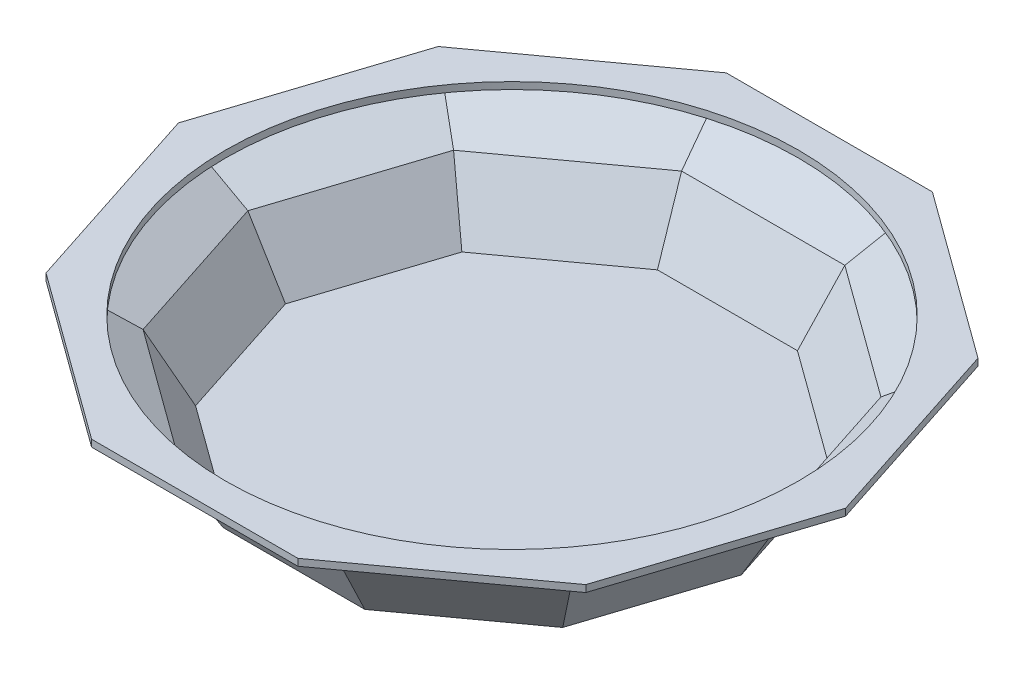
from build123d import *

# Parameters (mm, degrees)
STAGE1EX_DEPTH      = 30
STAGE1EX_DRAFT      = -30
STAGE1IN_DEPTH      = 27
STAGE1IN_DRAFT      = -30
STAGE2EX_DEPTH      = 15
STAGE2EX_DRAFT      = -60
STAGE2IN_DEPTH      = 20
STAGE2IN_DRAFT      = -60
SKETCH11_R          = 125
BOSS_EXTRUDE6_DEPTH = 3


with BuildPart() as part:
    # Sketch4 → Stage1Ex (with draft: the straight prism first)
    with BuildSketch(Plane(origin=(0, 0, 0), x_dir=(1, 0, 0), z_dir=(0, 1, 0))):
        Polygon((30.901699437, -95.10565163), (80.901699437, -58.778525229), (100, 0), (80.901699437, 58.778525229), (30.901699437, 95.10565163), (-30.901699437, 95.10565163), (-80.901699437, 58.778525229), (-100, 0), (-80.901699437, -58.778525229), (-30.901699437, -95.10565163), align=None)
    extrude(amount=STAGE1EX_DEPTH)
    # Stage1Ex: the draft: its side faces are tilted about the plane it starts from
    stage1ex_sides = [part.faces().sort_by_distance(p)[0] for p in [
        (55.901699437, 15, 76.942088429),
        (90.450849719, 15, 29.389262615),
        (90.450849719, 15, -29.389262615),
        (55.901699437, 15, -76.942088429),
        (0, 15, -95.10565163),
        (-55.901699437, 15, -76.942088429),
        (-90.450849719, 15, -29.389262615),
        (-90.450849719, 15, 29.389262615),
        (-55.901699437, 15, 76.942088429),
        (0, 15, 95.10565163),
    ]]
    draft(stage1ex_sides, Plane(origin=(0, 0, 0), x_dir=(1, 0, 0), z_dir=(0, 1, 0)), STAGE1EX_DRAFT)


with BuildPart() as stage1in_tool:
    # Sketch7 → Stage1In (with draft: the straight prism first)
    with BuildSketch(Plane(origin=(0, 30, 0), x_dir=(1, 0, 0), z_dir=(0, 1, 0))):
        Polygon((-115.211859946, 0), (-93.20835265, -67.719832166), (-35.602422677, -109.572990156), (35.602422677, -109.572990156), (93.20835265, -67.719832166), (115.211859946, 0), (93.20835265, 67.719832166), (35.602422677, 109.572990156), (-35.602422677, 109.572990156), (-93.20835265, 67.719832166), align=None)
    extrude(amount=-STAGE1IN_DEPTH)
    # Stage1In: the draft: its side faces are tilted about the plane it starts from
    stage1in_sides = [stage1in_tool.faces().sort_by_distance(p)[0] for p in [
        (-104.210106298, 16.5, 33.859916083),
        (-64.405387663, 16.5, 88.646411161),
        (0, 16.5, 109.572990156),
        (64.405387663, 16.5, 88.646411161),
        (104.210106298, 16.5, 33.859916083),
        (104.210106298, 16.5, -33.859916083),
        (64.405387663, 16.5, -88.646411161),
        (0, 16.5, -109.572990156),
        (-64.405387663, 16.5, -88.646411161),
        (-104.210106298, 16.5, -33.859916083),
    ]]
    draft(stage1in_sides, Plane(origin=(0, 30, 0), x_dir=(1, 0, 0), z_dir=(0, 1, 0)), STAGE1IN_DRAFT)


with BuildPart() as part_1:
    add(part.part)

    # Stage1In: cut by stage1in_tool
    add(stage1in_tool.part, mode=Mode.SUBTRACT)


with BuildPart() as stage2ex_tool:
    # Sketch8 → Stage2Ex (with draft: the straight prism first)
    with BuildSketch(Plane(origin=(0, 30, 0), x_dir=(1, 0, 0), z_dir=(0, 1, 0))):
        Polygon((36.52947366, 112.426159705), (-36.52947366, 112.426159705), (-95.635403633, 69.483187922), (-118.211859946, 0), (-95.635403633, -69.483187922), (-36.52947366, -112.426159705), (36.52947366, -112.426159705), (95.635403633, -69.483187922), (118.211859946, 0), (95.635403633, 69.483187922), align=None)
    extrude(amount=STAGE2EX_DEPTH)
    # Stage2Ex: the draft: its side faces are tilted about the plane it starts from
    stage2ex_sides = [stage2ex_tool.faces().sort_by_distance(p)[0] for p in [
        (0, 37.5, -112.426159705),
        (-66.082438647, 37.5, -90.954673814),
        (-106.92363179, 37.5, -34.741593961),
        (-106.92363179, 37.5, 34.741593961),
        (-66.082438647, 37.5, 90.954673814),
        (0, 37.5, 112.426159705),
        (66.082438647, 37.5, 90.954673814),
        (106.92363179, 37.5, 34.741593961),
        (106.92363179, 37.5, -34.741593961),
        (66.082438647, 37.5, -90.954673814),
    ]]
    draft(stage2ex_sides, Plane(origin=(0, 30, 0), x_dir=(1, 0, 0), z_dir=(0, 1, 0)), STAGE2EX_DRAFT)


with BuildPart() as part_2:
    add(part_1.part)

    # Stage2Ex: add stage2ex_tool
    add(stage2ex_tool.part)


with BuildPart() as stage2in_tool:
    # Sketch10 → Stage2In (with draft: the straight prism first)
    with BuildSketch(Plane(origin=(0, 45, 0), x_dir=(1, 0, 0), z_dir=(0, 1, 0))):
        Polygon((115.308908944, -83.776826205), (142.529649866, 0), (115.308908944, 83.776826205), (44.044084011, 135.55375227), (-44.044084011, 135.55375227), (-115.308908944, 83.776826205), (-142.529649866, 0), (-115.308908944, -83.776826205), (-44.044084011, -135.55375227), (44.044084011, -135.55375227), align=None)
    extrude(amount=-STAGE2IN_DEPTH)
    # Stage2In: the draft: its side faces are tilted about the plane it starts from
    stage2in_sides = [stage2in_tool.faces().sort_by_distance(p)[0] for p in [
        (128.919279405, 35, 41.888413103),
        (128.919279405, 35, -41.888413103),
        (79.676496477, 35, -109.665289238),
        (0, 35, -135.55375227),
        (-79.676496477, 35, -109.665289238),
        (-128.919279405, 35, -41.888413103),
        (-128.919279405, 35, 41.888413103),
        (-79.676496477, 35, 109.665289238),
        (0, 35, 135.55375227),
        (79.676496477, 35, 109.665289238),
    ]]
    draft(stage2in_sides, Plane(origin=(0, 45, 0), x_dir=(1, 0, 0), z_dir=(0, 1, 0)), STAGE2IN_DRAFT)


with BuildPart() as part_3:
    add(part_2.part)

    # Stage2In: cut by stage2in_tool
    add(stage2in_tool.part, mode=Mode.SUBTRACT)

    # Sketch11 → Boss-Extrude6 (add)
    with BuildSketch(Plane(origin=(0, 45, 0), x_dir=(1, 0, 0), z_dir=(0, 1, 0))):
        Polygon((117.735959927, -85.540181962), (145.529649866, 0), (117.735959927, 85.540181962), (44.971134994, 138.406921819), (-44.971134994, 138.406921819), (-117.735959927, 85.540181962), (-145.529649866, 0), (-117.735959927, -85.540181962), (-44.971134994, -138.406921819), (44.971134994, -138.406921819), align=None)
        with Locations(Location((0, 0, 0), (0, 0, 270))):
            Circle(SKETCH11_R, mode=Mode.SUBTRACT)
    extrude(amount=BOSS_EXTRUDE6_DEPTH)


solid = part_3.part
